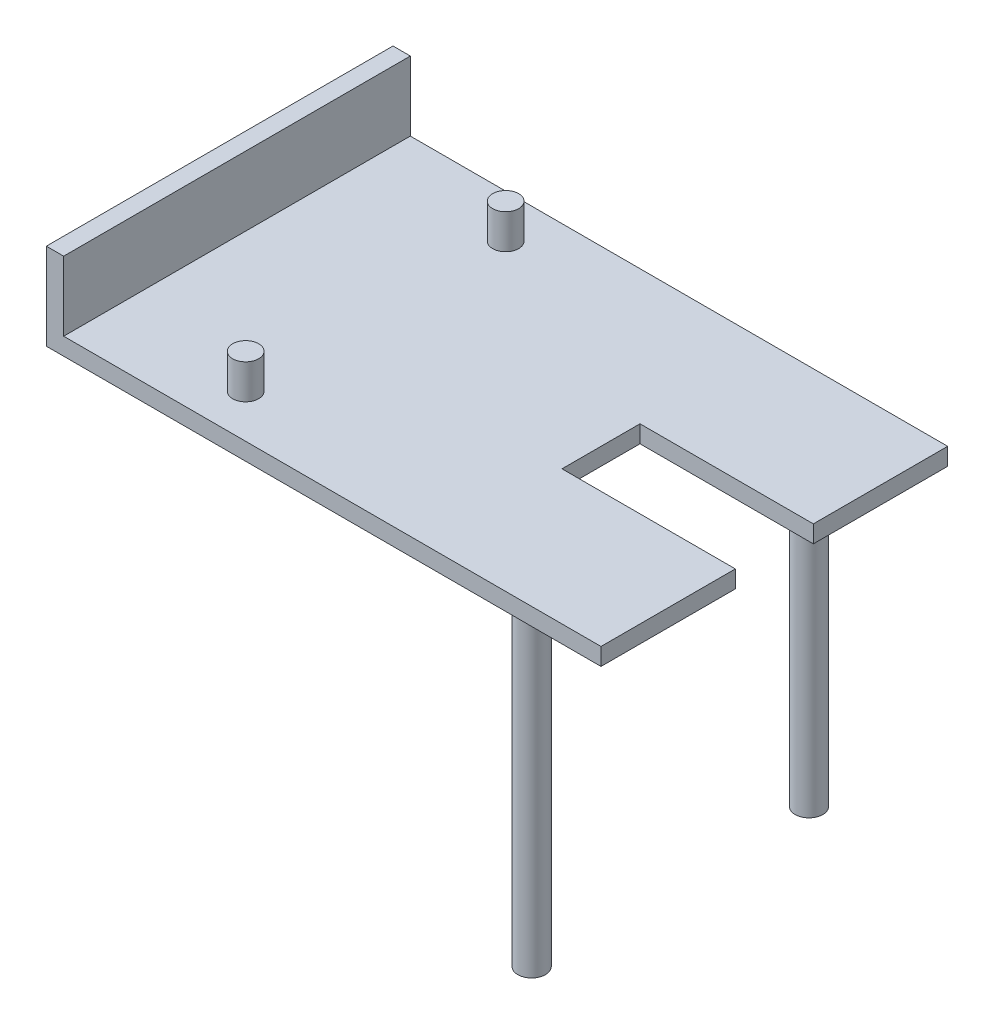
from build123d import *

# Parameters (mm, degrees)
ESQUISSE1_W             = 310
ESQUISSE1_H             = 10
ESQUISSE1_W_2           = 10
ESQUISSE1_H_2           = 40
BOSS_EXTRU_1_DEPTH      = 200
ESQUISSE2_R             = 7.5
BOSS_EXTRU_2_DEPTH      = 20
ESQUISSE3_R             = 8
BOSS_EXTRU_3_DEPTH      = 200
ESQUISSE4_W             = 100
ESQUISSE4_H             = 45
ENL_V_MAT_EXTRU_1_DEPTH = 10


with BuildPart() as part:
    # Esquisse1 → Boss.-Extru.1 (new body)
    with BuildSketch(Plane.XY):
        with Locations((165, 5)):
            Rectangle(ESQUISSE1_W, ESQUISSE1_H)
        with Locations((5, 30)):
            Rectangle(ESQUISSE1_W_2, ESQUISSE1_H_2)
        with Locations((5, 5)):
            Rectangle(ESQUISSE1_W_2, ESQUISSE1_H)
    extrude(amount=BOSS_EXTRU_1_DEPTH)

    # Esquisse2 → Boss.-Extru.2 (add)
    with BuildSketch(Plane(origin=(0, 10, 0), x_dir=(1, 0, 0), z_dir=(0, 1, 0))):
        with Locations(Location((90, -25, 0), (0, 0, 270))):
            Circle(ESQUISSE2_R)
        with Locations(Location((90, -175, 0), (0, 0, 270))):
            Circle(ESQUISSE2_R)
    extrude(amount=BOSS_EXTRU_2_DEPTH)

    # Esquisse3 → Boss.-Extru.3 (add)
    with BuildSketch(Plane(origin=(0, 10, 0), x_dir=(1, 0, 0), z_dir=(0, 1, 0))):
        with Locations(Location((260, -20, 0), (0, 0, 270))):
            Circle(ESQUISSE3_R)
        with Locations(Location((260, -180, 0), (0, 0, 270))):
            Circle(ESQUISSE3_R)
    extrude(amount=-BOSS_EXTRU_3_DEPTH)

    # Esquisse4 → Enlèv. mat.-Extru.1 (cut)
    with BuildSketch(Plane(origin=(0, 10, 0), x_dir=(1, 0, 0), z_dir=(0, 1, 0))):
        with Locations((270, -100)):
            Rectangle(ESQUISSE4_W, ESQUISSE4_H)
    extrude(amount=-ENL_V_MAT_EXTRU_1_DEPTH, mode=Mode.SUBTRACT)


solid = part.part
